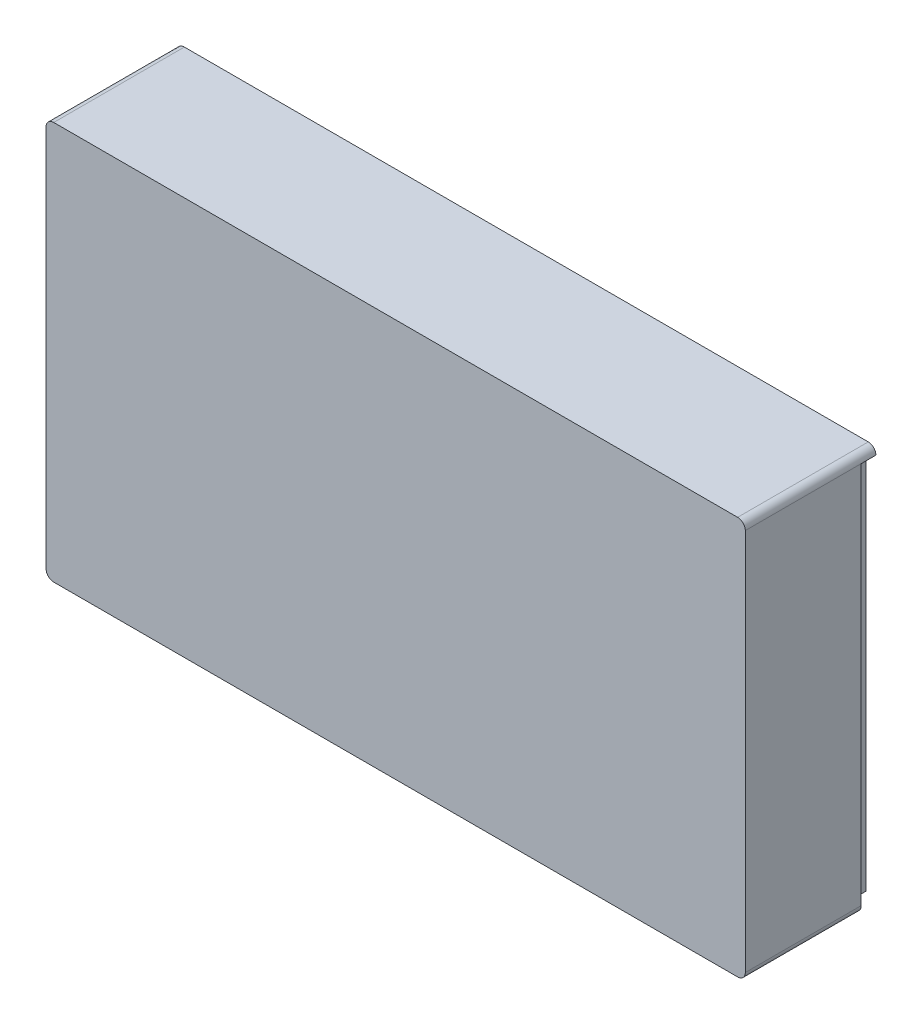
from build123d import *

# Parameters (mm, degrees)
SKETCH2_W           = 290
SKETCH2_H           = 165.1
BOSS_EXTRUDE1_DEPTH = 51
SKETCH3_W           = 290
SKETCH3_H           = 165.1
BOSS_EXTRUDE2_DEPTH = 3.175
CUT_EXTRUDE1_DEPTH  = 161.925
SKETCH7_W           = 7.175
SKETCH7_H           = 41.725
CUT_EXTRUDE3_DEPTH  = 158.75
FILLET1_R           = 3.175
SKETCH8_W           = 290
SKETCH8_H           = 6.1
CUT_EXTRUDE4_DEPTH  = 3.25


with BuildPart() as part:
    # Sketch2 → Boss-Extrude1 (new body)
    with BuildSketch(Plane.XY):
        Rectangle(SKETCH2_W, SKETCH2_H)
        Polygon((133.825, 71.375), (133.825, -71.375), (133.825, -79.375), (-133.825, -79.375), (-133.825, -71.375), (-133.825, 71.375), (-133.825, 79.375), (133.825, 79.375), align=None, mode=Mode.SUBTRACT)
    extrude(amount=BOSS_EXTRUDE1_DEPTH)

    # Sketch3 → Boss-Extrude2 (add)
    with BuildSketch(Plane.XY.offset(51)):
        Rectangle(SKETCH3_W, SKETCH3_H)
    extrude(amount=BOSS_EXTRUDE2_DEPTH)

    # Sketch4 → Cut-Extrude1 (cut)
    with BuildSketch(Plane.XZ.offset(82.55)):
        Polygon((140.9, 2.9), (136.9, 2.9), (136.9, 6.1), (145, 6.1), (145, 2.9), (145, 0), (140.9, 0), align=None)
    cut_extrude1 = extrude(amount=-CUT_EXTRUDE1_DEPTH, mode=Mode.SUBTRACT)

    # Mirror1: Cut-Extrude1 across plane
    add(cut_extrude1.mirror(Plane(origin=(0, 0, 0), x_dir=(0, 0, 1), z_dir=(1, 0, 0))), mode=Mode.SUBTRACT)

    # Sketch7 → Cut-Extrude3 (cut)
    with BuildSketch(Plane(origin=(0, 79.375, 0), x_dir=(1, 0, 0), z_dir=(0, 1, 0))):
        with Locations((137.4125, -30.1375)):
            Rectangle(SKETCH7_W, SKETCH7_H)
    cut_extrude3 = extrude(amount=-CUT_EXTRUDE3_DEPTH, mode=Mode.SUBTRACT)

    # Mirror4: Cut-Extrude3 across plane
    add(cut_extrude3.mirror(Plane(origin=(0, 0, 0), x_dir=(0, 0, 1), z_dir=(1, 0, 0))), mode=Mode.SUBTRACT)

    # Fillet1
    fillet1_edges = [part.edges().sort_by_distance(p)[0] for p in [
        (145, -82.55, 30.1375),
        (-145, -82.55, 30.1375),
        (-145, 82.55, 27.0875),
        (145, 82.55, 27.0875),
    ]]
    fillet(fillet1_edges, radius=FILLET1_R)

    # Sketch8 → Cut-Extrude4 (cut)
    with BuildSketch(Plane.XZ.offset(82.55)):
        with Locations((0, 3.05)):
            Rectangle(SKETCH8_W, SKETCH8_H)
    extrude(amount=-CUT_EXTRUDE4_DEPTH, mode=Mode.SUBTRACT)


solid = part.part
